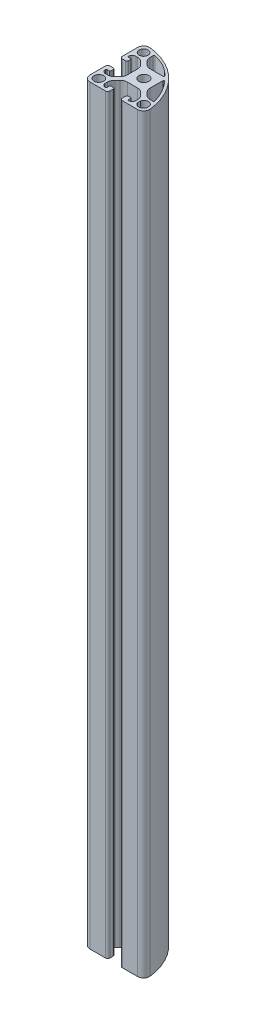
from build123d import *

# Parameters (mm, degrees)
CROQUIS1_R              = 3.35
SALIENTE_EXTRUIR1_DEPTH = 500
SALIENTE_EXTRUIR2_START = -500
SALIENTE_EXTRUIR2_DEPTH = 500


with BuildPart() as part:
    # Croquis1 → Saliente-Extruir1 (new body)
    with BuildSketch(Plane(origin=(0, 0, 0), x_dir=(1, 0, 0), z_dir=(0, 1, 0))):
        with BuildLine():
            Line((4.099999986, -16.349999949), (4.099999986, -18.499999949))
            ThreePointArc((4.099999986, -18.499999949), (4.539339815, -19.560660121), (5.599999987, -19.999999949))
            Line((5.599999987, -19.999999949), (15.777087623, -19.999999949))
            ThreePointArc((15.777087623, -19.999999949), (18.758511608, -18.66666665), (19.752319619, -15.555555546))
            ThreePointArc((19.752319619, -15.555555546), (8.284271243, 8.284271252), (-15.555555578, 19.752319582))
            ThreePointArc((-15.555555578, 19.752319582), (-18.666666685, 18.758511591), (-20.000000016, 15.777087623))
            Line((-20.000000016, 15.777087623), (-20.000000016, 5.599999985))
            ThreePointArc((-20.000000016, 5.599999985), (-19.560660185, 4.539339815), (-18.500000013, 4.099999988))
            Line((-18.500000013, 4.099999988), (-16.350000012, 4.099999988))
            ThreePointArc((-16.350000012, 4.099999988), (-15.642893231, 4.392893207), (-15.350000012, 5.099999988))
            Line((-15.350000012, 5.099999988), (-15.350000012, 6.599999984))
            ThreePointArc((-15.350000012, 6.599999984), (-15.49644662, 6.953553378), (-15.850000012, 7.099999989))
            Line((-15.850000012, 7.099999989), (-17.500000009, 7.099999989))
            ThreePointArc((-17.500000009, 7.099999989), (-17.853553401, 7.246446596), (-18.000000013, 7.599999985))
            ThreePointArc((-18.000000013, 7.599999985), (-17.267766972, 9.36776695), (-15.500000013, 10.100000003))
            Line((-15.500000013, 10.100000003), (-14.292388135, 10.100000003))
            ThreePointArc((-14.292388135, 10.100000003), (-12.378970991, 9.719397659), (-10.756854262, 8.635533909))
            Line((-10.756854262, 8.635533909), (-9.064466108, 6.943145756))
            ThreePointArc((-9.064466108, 6.943145756), (-7.980602349, 5.32102901), (-7.60000001, 3.407611846))
            Line((-7.60000001, 3.407611846), (-7.60000001, -3.407611843))
            ThreePointArc((-7.60000001, -3.407611843), (-7.980602347, -5.321029004), (-9.064466104, -6.943145748))
            Line((-9.064466104, -6.943145748), (-10.756854257, -8.635533901))
            ThreePointArc((-10.756854257, -8.635533901), (-12.378971003, -9.719397661), (-14.292388167, -10.099999999))
            Line((-14.292388167, -10.099999999), (-15.499999985, -10.099999999))
            ThreePointArc((-15.499999985, -10.099999999), (-17.267766956, -9.367766956), (-18.000000007, -7.599999987))
            ThreePointArc((-18.000000007, -7.599999987), (-17.853553397, -7.246446598), (-17.500000007, -7.099999989))
            Line((-17.500000007, -7.099999989), (-15.850000011, -7.099999989))
            ThreePointArc((-15.850000011, -7.099999989), (-15.496446618, -6.953553381), (-15.350000008, -6.599999989))
            Line((-15.350000008, -6.599999989), (-15.350000008, -5.099999989))
            ThreePointArc((-15.350000008, -5.099999989), (-15.642893227, -4.392893209), (-16.350000008, -4.09999999))
            Line((-16.350000008, -4.09999999), (-18.500000008, -4.09999999))
            ThreePointArc((-18.500000008, -4.09999999), (-19.56066018, -4.539339819), (-20.000000008, -5.599999991))
            Line((-20.000000008, -5.599999991), (-20.000000008, -15.999999939))
            ThreePointArc((-20.000000008, -15.999999939), (-18.828427101, -18.828427077), (-15.999999951, -19.999999954))
            Line((-15.999999951, -19.999999954), (-5.599999986, -19.999999954))
            ThreePointArc((-5.599999986, -19.999999954), (-4.539339818, -19.560660123), (-4.099999992, -18.499999954))
            Line((-4.099999992, -18.499999954), (-4.099999992, -16.349999953))
            ThreePointArc((-4.099999992, -16.349999953), (-4.392893211, -15.642893171), (-5.099999992, -15.349999953))
            Line((-5.099999992, -15.349999953), (-6.599999988, -15.349999953))
            ThreePointArc((-6.599999988, -15.349999953), (-6.953553382, -15.49644656), (-7.099999993, -15.849999953))
            Line((-7.099999993, -15.849999953), (-7.099999993, -17.499999952))
            ThreePointArc((-7.099999993, -17.499999952), (-7.2464466, -17.853553342), (-7.599999989, -17.999999954))
            ThreePointArc((-7.599999989, -17.999999954), (-9.367766954, -17.267766913), (-10.100000007, -15.499999954))
            Line((-10.100000007, -15.499999954), (-10.100000007, -14.292388076))
            ThreePointArc((-10.100000007, -14.292388076), (-9.719397663, -12.378970931), (-8.635533913, -10.756854202))
            Line((-8.635533913, -10.756854202), (-6.94314576, -9.064466049))
            ThreePointArc((-6.94314576, -9.064466049), (-5.321029014, -7.980602289), (-3.40761185, -7.599999951))
            Line((-3.40761185, -7.599999951), (3.407611837, -7.599999951))
            ThreePointArc((3.407611837, -7.599999951), (5.321028999, -7.980602288), (6.943145744, -9.064466044))
            Line((6.943145744, -9.064466044), (8.635533897, -10.756854198))
            ThreePointArc((8.635533897, -10.756854198), (9.719397657, -12.378970943), (10.099999995, -14.292388108))
            Line((10.099999995, -14.292388108), (10.099999995, -15.499999937))
            ThreePointArc((10.099999995, -15.499999937), (9.367766948, -17.267766901), (7.599999983, -17.999999948))
            ThreePointArc((7.599999983, -17.999999948), (7.246446594, -17.853553337), (7.099999985, -17.499999948))
            Line((7.099999985, -17.499999948), (7.099999985, -15.849999952))
            ThreePointArc((7.099999985, -15.849999952), (6.953553377, -15.496446559), (6.599999985, -15.349999949))
            Line((6.599999985, -15.349999949), (5.099999986, -15.349999949))
            ThreePointArc((5.099999986, -15.349999949), (4.392893205, -15.642893168), (4.099999986, -16.349999949))
        make_face()
        with Locations(Location((0, 0, 0), (0, 0, 270))):
            Circle(CROQUIS1_R, mode=Mode.SUBTRACT)
        with BuildLine():
            Line((-18.200000016, 12.299999981), (-18.200000016, 15.777087623))
            ThreePointArc((-18.200000016, 15.777087623), (-17.466666684, 17.416870805), (-15.755555575, 17.963465201))
            ThreePointArc((-15.755555575, 17.963465201), (-13.970008189, 17.721071), (-12.197878052, 17.394744174))
            ThreePointArc((-12.197878052, 17.394744174), (-11.91201741, 17.22067196), (-11.800000067, 16.905284013))
            Line((-11.800000067, 16.905284013), (-11.800000067, 12.299999704))
            ThreePointArc((-11.800000067, 12.299999704), (-11.946446503, 11.946446622), (-12.299999521, 11.800000031))
            Line((-12.299999521, 11.800000031), (-17.700000056, 11.800000031))
            ThreePointArc((-17.700000056, 11.800000031), (-18.053553418, 11.946446622), (-18.200000016, 12.299999981))
        make_face(mode=Mode.SUBTRACT)
        with BuildLine():
            Line((11.800000005, -17.699999962), (11.800000005, -12.299999803))
            ThreePointArc((11.800000005, -12.299999803), (11.946446442, -11.946446721), (12.299999459, -11.80000013))
            Line((12.299999459, -11.80000013), (16.905284227, -11.80000013))
            ThreePointArc((16.905284227, -11.80000013), (17.220672032, -11.912017476), (17.394744196, -12.197877993))
            ThreePointArc((17.394744196, -12.197877993), (17.721071033, -13.970008163), (17.963465241, -15.755555583))
            ThreePointArc((17.963465241, -15.755555583), (17.416870817, -17.466666655), (15.777087646, -18.199999948))
            Line((15.777087646, -18.199999948), (12.300000016, -18.199999948))
            ThreePointArc((12.300000016, -18.199999948), (11.946446626, -18.053553344), (11.800000005, -17.699999962))
        make_face(mode=Mode.SUBTRACT)
        with BuildLine():
            Line((-18.200000037, -15.999999938), (-18.200000037, -12.29999998))
            ThreePointArc((-18.200000037, -12.29999998), (-18.053553433, -11.94644659), (-17.70000005, -11.799999969))
            Line((-17.70000005, -11.799999969), (-12.299999814, -11.799999969))
            ThreePointArc((-12.299999814, -11.799999969), (-11.946446646, -11.946446393), (-11.800000043, -12.299999487))
            Line((-11.800000043, -12.299999487), (-11.800000043, -17.700000023))
            ThreePointArc((-11.800000043, -17.700000023), (-11.946446635, -18.053553384), (-12.299999994, -18.199999983))
            Line((-12.299999994, -18.199999983), (-15.999999951, -18.199999983))
            ThreePointArc((-15.999999951, -18.199999983), (-17.555634915, -17.555634891), (-18.200000037, -15.999999938))
        make_face(mode=Mode.SUBTRACT)
        with BuildLine():
            Line((-10.100000018, 14.292388152), (-10.100000018, 16.237135643))
            ThreePointArc((-10.100000018, 16.237135643), (-9.900860854, 16.636488564), (-9.462068989, 16.717734255))
            ThreePointArc((-9.462068989, 16.717734255), (-1.335812596, 13.79371517), (5.466577064, 8.472679041))
            ThreePointArc((5.466577064, 8.472679041), (5.600331365, 7.921589685), (5.133244904, 7.599999995))
            Line((5.133244904, 7.599999995), (-3.407611859, 7.599999995))
            ThreePointArc((-3.407611859, 7.599999995), (-5.321029022, 7.980602332), (-6.943145766, 9.064466088))
            Line((-6.943145766, 9.064466088), (-8.63553392, 10.756854242))
            ThreePointArc((-8.63553392, 10.756854242), (-9.719397679, 12.378970987), (-10.100000018, 14.292388152))
        make_face(mode=Mode.SUBTRACT)
        with BuildLine():
            Line((16.237135661, -10.099999987), (14.292388142, -10.099999987))
            ThreePointArc((14.292388142, -10.099999987), (12.378970987, -9.719397647), (10.75685425, -8.635533892))
            Line((10.75685425, -8.635533892), (9.064466096, -6.943145739))
            ThreePointArc((9.064466096, -6.943145739), (7.980602337, -5.321028994), (7.599999998, -3.407611829))
            Line((7.599999998, -3.407611829), (7.599999998, 5.133244926))
            ThreePointArc((7.599999998, 5.133244926), (7.921589687, 5.600331384), (8.472679039, 5.466577086))
            ThreePointArc((8.472679039, 5.466577086), (13.438953564, -1.531746557), (16.71773428, -9.462068964))
            ThreePointArc((16.71773428, -9.462068964), (16.636488582, -9.900860826), (16.237135661, -10.099999987))
        make_face(mode=Mode.SUBTRACT)
    extrude(amount=SALIENTE_EXTRUIR1_DEPTH)

    # Croquis2 → Saliente-Extruir2 (add)
    with BuildSketch(Plane(origin=(0, 500, 0), x_dir=(1, 0, 0), z_dir=(0, 1, 0)).offset(SALIENTE_EXTRUIR2_START)):
        with BuildLine():
            ThreePointArc((-15.00000005, -11.799999969), (-12.737258345, -12.737258271), (-11.800000043, -14.999999976))
            Line((-11.800000043, -14.999999976), (-11.800000043, -12.299999487))
            ThreePointArc((-11.800000043, -12.299999487), (-11.946446646, -11.946446393), (-12.299999814, -11.799999969))
            Line((-12.299999814, -11.799999969), (-15.00000005, -11.799999969))
        make_face()
        with BuildLine():
            ThreePointArc((-11.800000043, -14.999999976), (-12.737258345, -17.26274168), (-15.00000005, -18.199999983))
            Line((-15.00000005, -18.199999983), (-12.299999994, -18.199999983))
            ThreePointArc((-12.299999994, -18.199999983), (-11.946446635, -18.053553384), (-11.800000043, -17.700000023))
            Line((-11.800000043, -17.700000023), (-11.800000043, -14.999999976))
        make_face()
        with BuildLine():
            ThreePointArc((-18.200000037, -15.999999938), (-17.555634915, -17.555634891), (-15.999999951, -18.199999983))
            Line((-15.999999951, -18.199999983), (-15.00000005, -18.199999983))
            ThreePointArc((-15.00000005, -18.199999983), (-17.262741755, -17.26274168), (-18.200000057, -14.999999976))
            Line((-18.200000037, -14.999999976), (-18.200000037, -15.999999938))
        make_face()
        with BuildLine():
            Line((-18.200000037, -12.29999998), (-18.200000037, -14.999999976))
            ThreePointArc((-18.200000057, -14.999999976), (-17.262741755, -12.737258271), (-15.00000005, -11.799999969))
            Line((-15.00000005, -11.799999969), (-17.70000005, -11.799999969))
            ThreePointArc((-17.70000005, -11.799999969), (-18.053553433, -11.94644659), (-18.200000037, -12.29999998))
        make_face()
        with BuildLine():
            ThreePointArc((-15.755555575, 17.963465201), (-17.466666684, 17.416870805), (-18.200000016, 15.777087623))
            Line((-18.200000016, 15.777087623), (-18.200000016, 12.299999981))
            ThreePointArc((-18.200000016, 12.299999981), (-18.053553418, 11.946446622), (-17.700000056, 11.800000031))
            Line((-17.700000056, 11.800000031), (-14.992840663, 11.800000031))
            ThreePointArc((-14.992840663, 11.800000031), (-18.006058488, 15.03645487), (-14.562863205, 17.811076975))
            ThreePointArc((-14.562863205, 17.811076975), (-15.158609779, 17.891964046), (-15.755555575, 17.963465201))
        make_face()
        with BuildLine():
            ThreePointArc((-12.197878052, 17.394744174), (-13.37709835, 17.621498805), (-14.562863205, 17.811076975))
            ThreePointArc((-14.562863205, 17.811076975), (-12.709765496, 16.799175178), (-11.971923864, 14.82091683))
            ThreePointArc((-11.971923864, 14.82091683), (-12.856729909, 12.684806076), (-14.992840663, 11.800000031))
            Line((-14.992840663, 11.800000031), (-12.299999521, 11.800000031))
            ThreePointArc((-12.299999521, 11.800000031), (-11.946446503, 11.946446622), (-11.800000067, 12.299999704))
            Line((-11.800000067, 12.299999704), (-11.800000067, 16.905284013))
            ThreePointArc((-11.800000067, 16.905284013), (-11.91201741, 17.22067196), (-12.197878052, 17.394744174))
        make_face()
        with BuildLine():
            Line((16.905284227, -11.80000013), (14.828541229, -11.80000013))
            ThreePointArc((14.828541229, -11.80000013), (16.461401303, -12.247952184), (17.637109474, -13.466395191))
            ThreePointArc((17.637109474, -13.466395191), (17.521287961, -12.831112285), (17.394744196, -12.197877993))
            ThreePointArc((17.394744196, -12.197877993), (17.220672032, -11.912017476), (16.905284227, -11.80000013))
        make_face()
        with BuildLine():
            Line((11.800000005, -12.299999803), (11.800000005, -13.966589436))
            ThreePointArc((11.800000005, -13.966589436), (12.966675823, -12.397413513), (14.828541229, -11.80000013))
            Line((14.828541229, -11.80000013), (12.299999459, -11.80000013))
            ThreePointArc((12.299999459, -11.80000013), (11.946446442, -11.946446721), (11.800000005, -12.299999803))
        make_face()
        with BuildLine():
            ThreePointArc((11.800000005, -17.699999962), (11.946446626, -18.053553344), (12.300000016, -18.199999948))
            Line((12.300000016, -18.199999948), (14.828541229, -18.199999948))
            ThreePointArc((14.828541229, -18.199999948), (12.966675823, -17.602586565), (11.800000005, -16.033410642))
            Line((11.800000005, -16.033410642), (11.800000005, -17.699999962))
        make_face()
        with BuildLine():
            ThreePointArc((17.955118446, -15.681552916), (16.835906452, -17.492084364), (14.828541229, -18.199999948))
            Line((14.828541229, -18.199999948), (15.777087646, -18.199999948))
            ThreePointArc((15.777087646, -18.199999948), (17.416870817, -17.466666655), (17.963465241, -15.755555583))
            ThreePointArc((17.963465241, -15.755555583), (17.959309877, -15.718552215), (17.955118446, -15.681552916))
        make_face()
    extrude(amount=SALIENTE_EXTRUIR2_DEPTH)


solid = part.part
